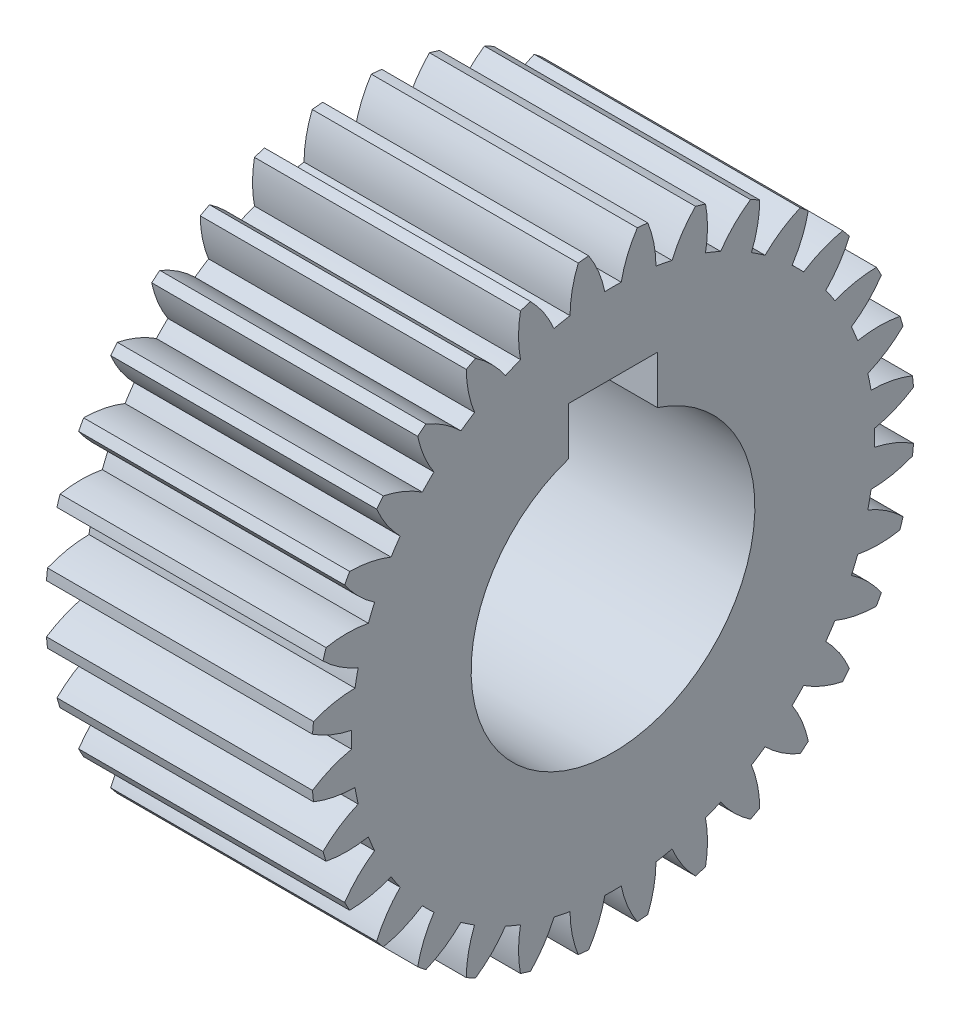
from build123d import *

# Parameters (mm, degrees)
BASPROSKE_W     = 15
BASPROSKE_H     = 17
TOOTHCUT_DEPTH  = 29.337254631
TEETHCUTS_COUNT = 32
TEETHCUTS_ANGLE = 348.75
BORSKE_R        = 8
BORE_DEPTH      = 50.0000508
KEYSKE_W        = 5
KEYSKE_H        = 10.3
KEYWAY_DEPTH    = 50.0000508


with BuildPart() as part:
    # BasProSke → Base-Revolve (revolve)
    with BuildSketch(Plane(origin=(0, 0, 0), x_dir=(1, 0, 0), z_dir=(0, 1, 0)), mode=Mode.PRIVATE) as base_revolve_sk:
        with Locations((7.5, 8.5)):
            Rectangle(BASPROSKE_W, BASPROSKE_H)
    revolve(base_revolve_sk.sketch.rotate(Axis((-10, 0, 0), (1, 0, 0)), 180), axis=Axis((-10, 0, 0), (1, 0, 0)))

    # TooCutSke → ToothCut (cut, through all)
    with BuildSketch(Plane(origin=(0, 0, 0), x_dir=(0, 0, -1), z_dir=(1, 0, 0))):
        with BuildLine():
            ThreePointArc((0.462036907, 14.741761187), (0, 14.749), (-0.462036907, 14.741761187))
            ThreePointArc((-0.462036907, 14.741761187), (-0.81854142, 15.899240468), (-1.386721275, 16.9688317))
            ThreePointArc((-1.386721275, 16.9688317), (0, 17.0254), (1.386721275, 16.9688317))
            ThreePointArc((1.386721275, 16.9688317), (0.81854142, 15.899240468), (0.462036907, 14.741761187))
        make_face()
    toothcut = extrude(amount=TOOTHCUT_DEPTH, mode=Mode.SUBTRACT)

    # TeethCuts: ToothCut ×32 about axis
    teethcuts_axis = Axis((-10, 0, 0), (1, 0, 0))
    for i in range(1, TEETHCUTS_COUNT):
        add(toothcut.rotate(teethcuts_axis, i * TEETHCUTS_ANGLE / (TEETHCUTS_COUNT - 1)), mode=Mode.SUBTRACT)

    # BorSke → Bore (cut, symmetric)
    with BuildSketch(Plane(origin=(0, 0, 0), x_dir=(0, 0, -1), z_dir=(1, 0, 0))):
        with Locations(Location((0, 0, 0), (0, 0, 180))):
            Circle(BORSKE_R)
    extrude(amount=BORE_DEPTH, both=True, mode=Mode.SUBTRACT)

    # KeySke → Keyway (cut, symmetric)
    with BuildSketch(Plane(origin=(0, 0, 0), x_dir=(0, 0, -1), z_dir=(1, 0, 0))):
        with Locations((0, 5.15)):
            Rectangle(KEYSKE_W, KEYSKE_H)
    extrude(amount=KEYWAY_DEPTH, both=True, mode=Mode.SUBTRACT)


solid = part.part
